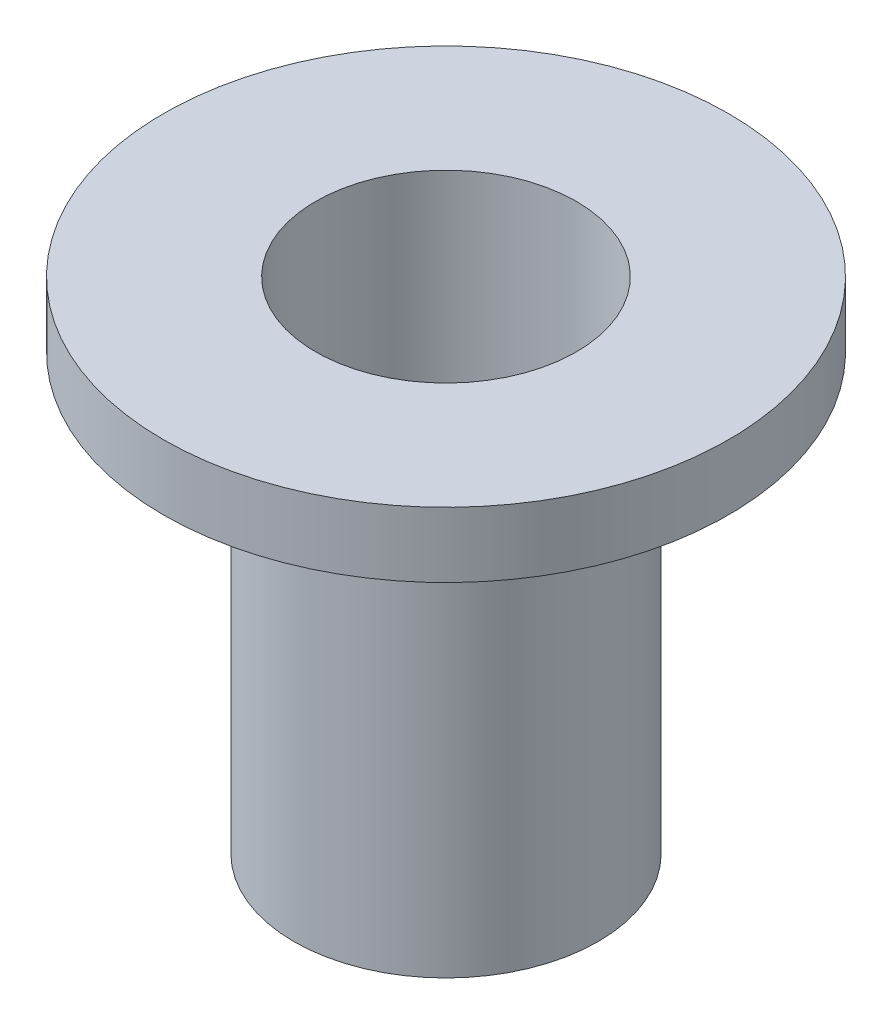
from build123d import *


with BuildPart() as part:
    # Sketch2 → Revolve1 (revolve)
    with BuildSketch(Plane.XY, mode=Mode.PRIVATE) as revolve1_sk:
        Polygon((6, 16.846153846), (6, -3.153846154), (7, -3.153846154), (7, 16.846153846), (13, 16.846153846), (13, 19.846153846), (6, 19.846153846), align=None)
    revolve(revolve1_sk.sketch.rotate(Axis((0, 0, 0), (0, 1, 0)), 90), axis=Axis((0, 0, 0), (0, 1, 0)))


solid = part.part
